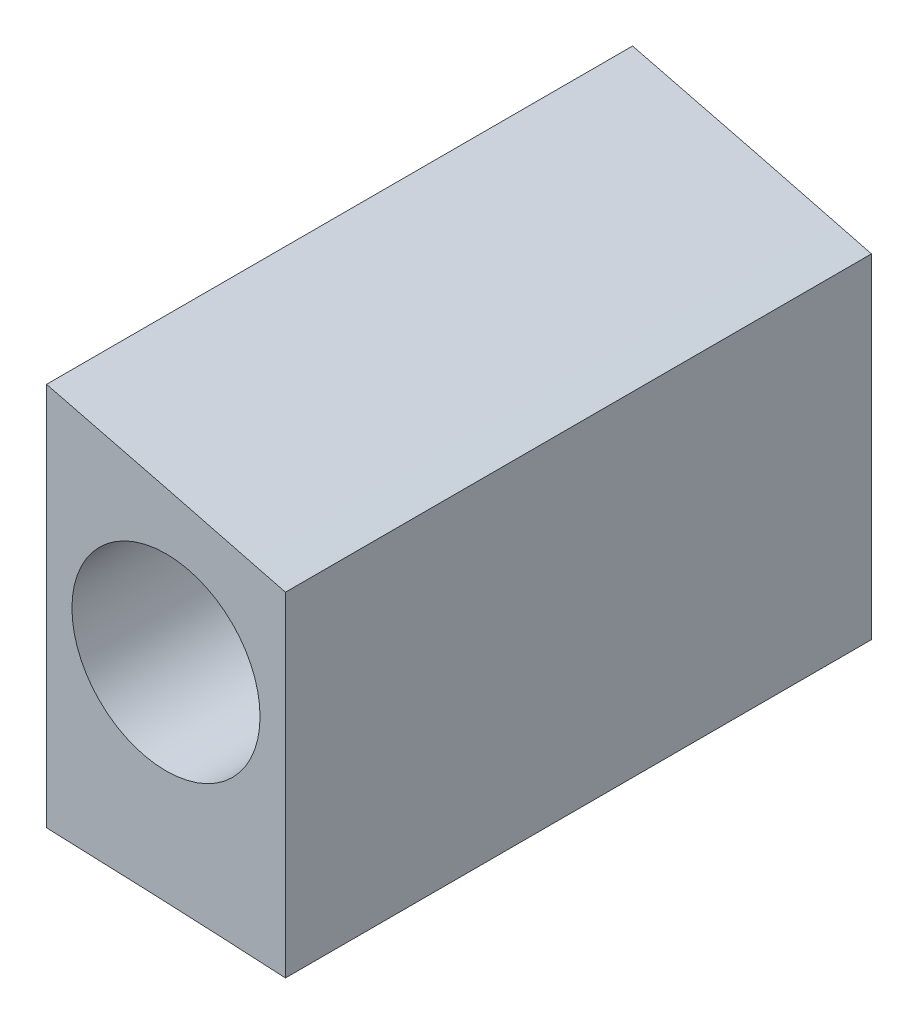
from build123d import *

# Parameters (mm, degrees)
BOSS_EXTRUDE1_DEPTH = 31.1531
SKETCH2_R           = 6.35
SKETCH2_R_2         = 5
CUT_EXTRUDE1_DEPTH  = 318.261218693
SKETCH3_W           = 116.84
SKETCH3_H           = 50.8
CUT_EXTRUDE2_DEPTH  = 318.261218693
SKETCH4_W           = 250.150530068
SKETCH4_H           = 117.489254048
CUT_EXTRUDE3_DEPTH  = 241.601180007


with BuildPart() as part:
    # Sketch1 → Boss-Extrude1 (new body)
    with BuildSketch(Plane.XY):
        with BuildLine():
            add(Edge.make_bspline(
                [(0.000560351, 0.000130087), (0.810633127, 7.359196055), (8.649092025, 17.856605174), (26.286719818, 29.975176328), (52.111128271, 42.069215275), (89.597618475, 49.290763054), (131.400792109, 47.884831915), (173.256699242, 40.041104278), (217.961060472, 29.612974894), (256.952064401, 19.528920948), (290.35983767, 8.71099439), (301.273197721, 4.382828139), (314.816918223, -0.516206742), (309.846313895, 0.000130087)],
                knots=[0, 0, 0, 0, 0.060863618, 0.113688265, 0.188608742, 0.312908923, 0.448482434, 0.557612135, 0.691544113, 0.852438279, 0.92975597, 0.976058229, 1, 1, 1, 1], degree=3))
            add(Edge.make_bspline(
                [(309.846313895, 0.000130087), (303.956832565, 1.47095521), (293.989507544, 2.093987313), (276.26402299, 4.514356704), (260.846344817, 5.427413394), (235.858814759, 7.870306192), (205.101424636, 8.838080282), (157.718638092, 9.030650149), (110.497331172, 6.181495223), (66.506197185, -0.586669107), (36.454672816, -6.098499901), (15.316603331, -6.189065841), (1.230714189, -6.924076091), (0.000560351, 0.000130087)],
                knots=[0, 0, 0, 0, 0.057787081, 0.095274891, 0.171021118, 0.205339302, 0.335319146, 0.464904334, 0.658702312, 0.785511947, 0.893517288, 0.94309214, 1, 1, 1, 1], degree=3))
        make_face()
    extrude(amount=BOSS_EXTRUDE1_DEPTH)

    # Sketch2 → Cut-Extrude1 (cut, through all)
    with BuildSketch(Plane.XY.offset(31.1531)):
        with Locations((20.32, 10.16)):
            Circle(SKETCH2_R)
        with Locations((227.296313895, 19.050130087)):
            Circle(SKETCH2_R_2)
    extrude(amount=-CUT_EXTRUDE1_DEPTH, mode=Mode.SUBTRACT)

    # Sketch3 → Cut-Extrude2 (cut, through all)
    with BuildSketch(Plane.XY.offset(31.1531)):
        with Locations((292.066313895, 19.050130087)):
            Rectangle(SKETCH3_W, SKETCH3_H)
    extrude(amount=-CUT_EXTRUDE2_DEPTH, mode=Mode.SUBTRACT)

    # Sketch4 → Cut-Extrude3 (cut, through all)
    with BuildSketch(Plane.XY.offset(31.1531)):
        with Locations((95.871048861, 34.528076629)):
            Rectangle(SKETCH4_W, SKETCH4_H)
    extrude(amount=-CUT_EXTRUDE3_DEPTH, mode=Mode.SUBTRACT)


solid = part.part
